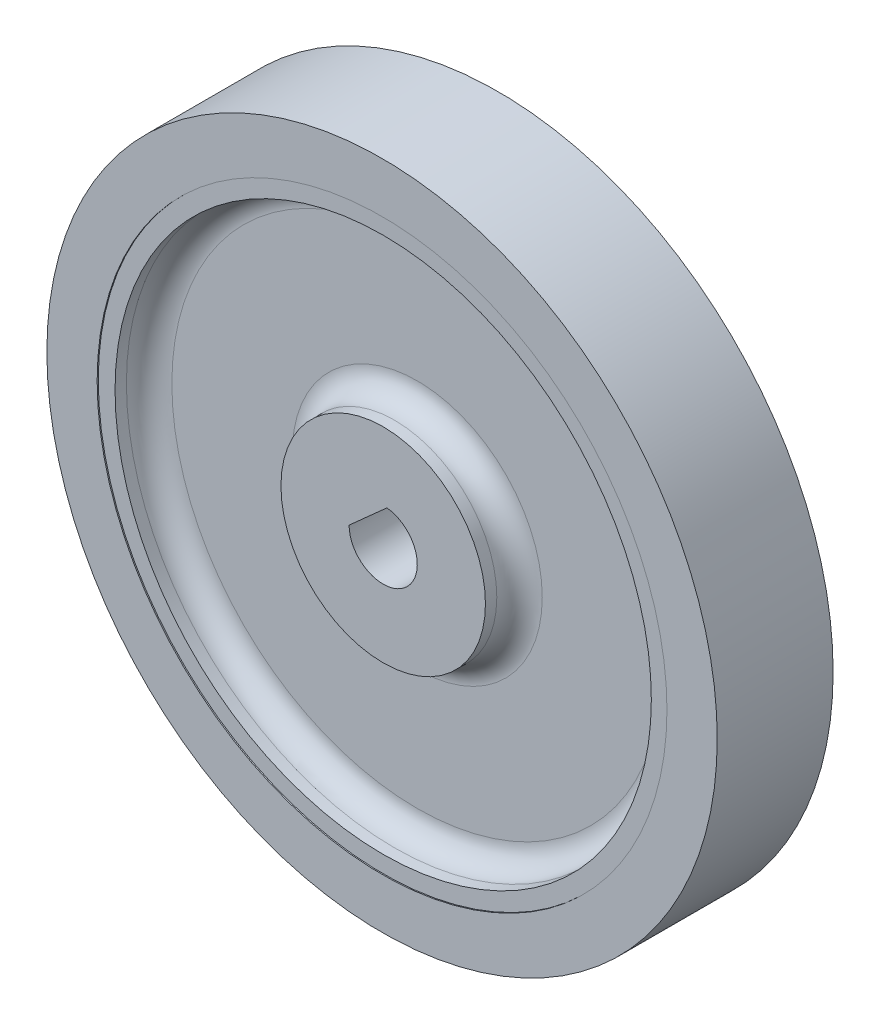
from build123d import *

# Parameters (mm, degrees)
ESQUISSE1_R           = 9
BOSS_EXTRU_1_DEPTH    = 5
ESQUISSE1_R_2         = 25.075
ESQUISSE1_R_3         = 23.6
BOSS_EXTRU_1_2_DEPTH  = 5
ESQUISSE1_3_R         = 23.6
ESQUISSE1_3_R_2       = 9
BOSS_EXTRU_2_DEPTH    = 2
ESQUISSE1_4_R         = 29.5
ESQUISSE1_4_R_2       = 25.075
BOSS_EXTRU_3_DEPTH    = 5.1
CONG_1_R              = 2
CONG_1_OF_SYM_TRIE1_R = 2


with BuildPart() as part:
    # Esquisse1 → Boss.-Extru.1 (new body)
    with BuildSketch(Plane.XY):
        Circle(ESQUISSE1_R)
        with BuildLine():
            ThreePointArc((-3, 0), (2.001193394, -2.235), (0.33015, 2.981778157))
            Line((0.33015, 2.981778157), (-3, 0))
        make_face(mode=Mode.SUBTRACT)
    boss_extru_1 = extrude(amount=BOSS_EXTRU_1_DEPTH)



with BuildPart() as body_2:
    # Esquisse1 → Boss.-Extru.1 2 (new body)
    with BuildSketch(Plane.XY):
        Circle(ESQUISSE1_R_2)
        Circle(ESQUISSE1_R_3, mode=Mode.SUBTRACT)
    boss_extru_1_2 = extrude(amount=BOSS_EXTRU_1_2_DEPTH)


with BuildPart() as part_1:
    add(part.part)

    add(body_2.part)  # Boss.-Extru.2 merges body 2
    # Esquisse1<3> → Boss.-Extru.2 (add)
    with BuildSketch(Plane.XY):
        Circle(ESQUISSE1_3_R)
        Circle(ESQUISSE1_3_R_2, mode=Mode.SUBTRACT)
    boss_extru_2 = extrude(amount=BOSS_EXTRU_2_DEPTH)

    # Esquisse1<4> → Boss.-Extru.3 (add)
    with BuildSketch(Plane.XY):
        Circle(ESQUISSE1_4_R)
        Circle(ESQUISSE1_4_R_2, mode=Mode.SUBTRACT)
    boss_extru_3 = extrude(amount=BOSS_EXTRU_3_DEPTH)

    # Congé1
    cong_1_edges = [part_1.edges().sort_by_distance(p)[0] for p in [
        (-9, 0, 2),
        (-23.6, 0, 2),
    ]]
    fillet(cong_1_edges, radius=CONG_1_R)


with BuildPart() as sym_trie1_1:
    # Symétrie1: Boss.-Extru.1, Boss.-Extru.1 2, Boss.-Extru.2, Boss.-Extru.3 across Front Plane
    add(boss_extru_1.mirror(Plane.XY))
    add(boss_extru_1_2.mirror(Plane.XY))
    add(boss_extru_2.mirror(Plane.XY))
    add(boss_extru_3.mirror(Plane.XY))

    # Congé1 of Symétrie1
    cong_1_of_sym_trie1_edges = [sym_trie1_1.edges().sort_by_distance(p)[0] for p in [
        (-9, 0, -2),
        (-23.6, 0, -2),
    ]]
    fillet(cong_1_of_sym_trie1_edges, radius=CONG_1_OF_SYM_TRIE1_R)


with BuildPart() as part_2:
    add(part_1.part)

    # Symétrie1 united with what the copies to: union Symétrie1_1
    add(sym_trie1_1.part)


solid = part_2.part
